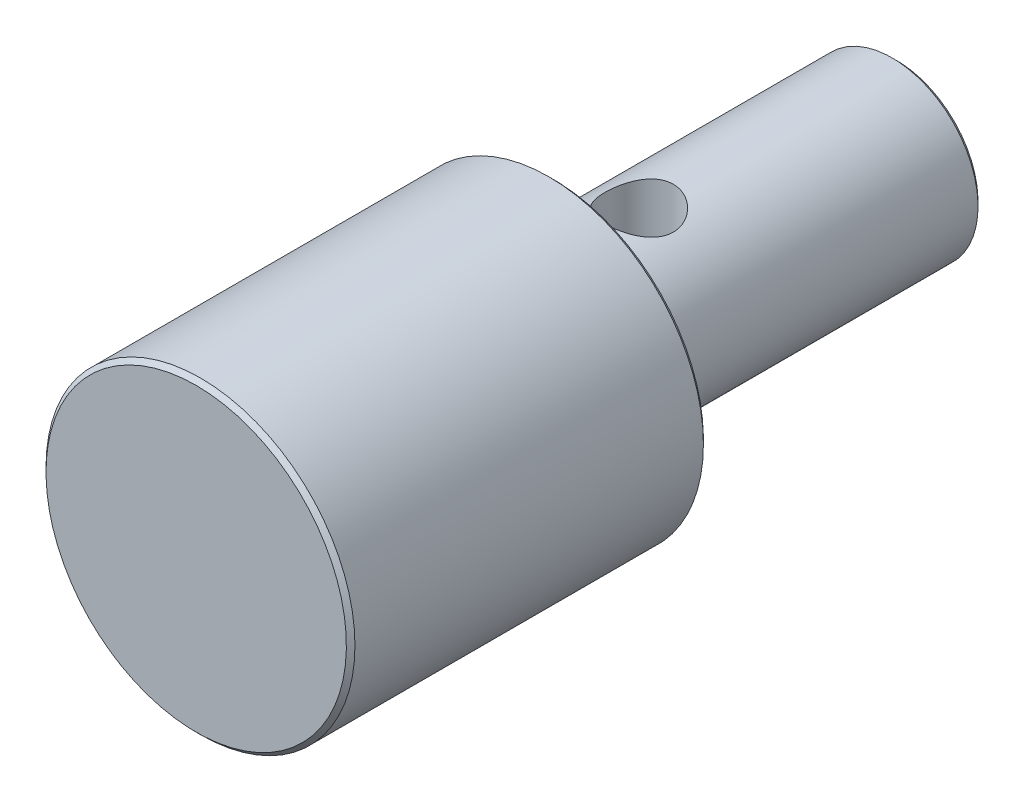
from build123d import *

# Parameters (mm, degrees)
SKETCH_2_R          = 4
CUT_EXTRUDE_1_DEPTH = 89.128088598
FILLET_1_R          = 0.5
CHAMFER_1_SIZE      = 0.5


with BuildPart() as part:
    # Эскиз1 → Повернуть1 (revolve)
    with BuildSketch(Plane(origin=(0, 0, 0), x_dir=(0, 0, -1), z_dir=(1, 0, 0)), mode=Mode.PRIVATE) as revolve_1_sk:
        Polygon((0, 0), (0, 18), (41.6, 18), (41.6, 10), (81.6, 10), (81.6, 0), align=None)
    revolve(revolve_1_sk.sketch.rotate(Axis((0, 0, 0), (0, 0, -1)), 180), axis=Axis((0, 0, 0), (0, 0, -1)))

    # Эскиз2 → Вырез-Вытянуть1 (cut, through all)
    with BuildSketch(Plane(origin=(0, 10, 0), x_dir=(1, 0, 0), z_dir=(0, 1, 0))):
        with Locations(Location((0, 51.6, 0), (0, 0, 269.999999991))):
            Circle(SKETCH_2_R)
    extrude(amount=-CUT_EXTRUDE_1_DEPTH, mode=Mode.SUBTRACT)

    # Скругление1
    fillet_1_edges = [part.edges().sort_by_distance(p)[0] for p in [
        (0, 10, -41.6),
    ]]
    fillet(fillet_1_edges, radius=FILLET_1_R)

    # Фаска1
    chamfer_1_edges = [part.edges().sort_by_distance(p)[0] for p in [
        (0, 10, -81.6),
        (0, 18, -41.6),
        (0, 18, 0),
    ]]
    chamfer(chamfer_1_edges, length=CHAMFER_1_SIZE)


solid = part.part
